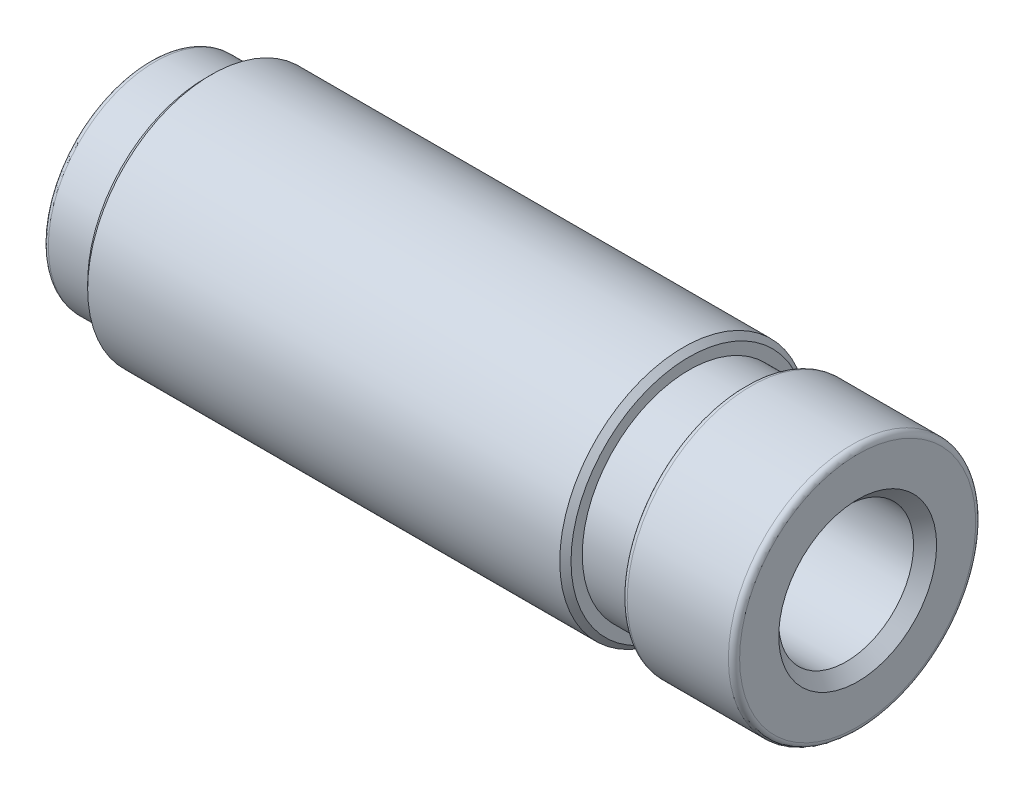
from build123d import *

# Parameters (mm, degrees)
FURO_ROSCADO_DE_M141_D           = 12
FURO_ROSCADO_DE_M141_DEPTH       = 50
FURO_ROSCADO_DE_M141_CSINK_D     = 14.05
FURO_ROSCADO_DE_M141_CSINK_ANGLE = 90
FURO_ROSCADO_DE_M141_TIP         = 3.605163714
FURO1_D                          = 9.68
FILETE1_R                        = 0.5
FILETE2_R                        = 1.5
CHANFRO1_SIZE                    = 0.5


with BuildPart() as part:
    # Esboço1 → Revolução1 (revolve)
    with BuildSketch(Plane.XY, mode=Mode.PRIVATE) as revolu_o1_sk:
        Polygon((0, 0), (63, 0), (63, 11), (53, 11), (53, 9.5), (48, 9.5), (48, 11), (5, 11), (5, 9.5), (0, 9.5), align=None)
    revolve(revolu_o1_sk.sketch.rotate(Axis((0, 0, 0), (1, 0, 0)), 90), axis=Axis((0, 0, 0), (1, 0, 0)))

    # Furo roscado de M141
    with Locations(Plane(origin=(63, 0, 0), x_dir=(0, 0, -1), z_dir=(1, 0, 0))):
        with Locations((0, 0)):
            CounterSinkHole(FURO_ROSCADO_DE_M141_D / 2, FURO_ROSCADO_DE_M141_CSINK_D / 2, depth=FURO_ROSCADO_DE_M141_DEPTH, counter_sink_angle=FURO_ROSCADO_DE_M141_CSINK_ANGLE)
            with Locations((0, 0, -(FURO_ROSCADO_DE_M141_DEPTH + FURO_ROSCADO_DE_M141_TIP / 2))):  # 118° drill point
                Cone(0, FURO_ROSCADO_DE_M141_D / 2, FURO_ROSCADO_DE_M141_TIP, mode=Mode.SUBTRACT)

    # Furo1 (through all)
    with Locations(Plane.ZY):
        with Locations((0, 0)):
            Hole(FURO1_D / 2)

    # Filete1
    filete1_edges = [part.edges().sort_by_distance(p)[0] for p in [
        (63, 0, -11),
        (0, 0, -9.5),
        (53, 0, -11),
    ]]
    fillet(filete1_edges, radius=FILETE1_R)

    # Filete2
    filete2_edges = [part.edges().sort_by_distance(p)[0] for p in [
        (0, 0, 4.84),
    ]]
    fillet(filete2_edges, radius=FILETE2_R)

    # Chanfro1
    chanfro1_edges = [part.edges().sort_by_distance(p)[0] for p in [
        (5, 0, -11),
        (48, 0, -11),
    ]]
    chamfer(chanfro1_edges, length=CHANFRO1_SIZE)


solid = part.part
